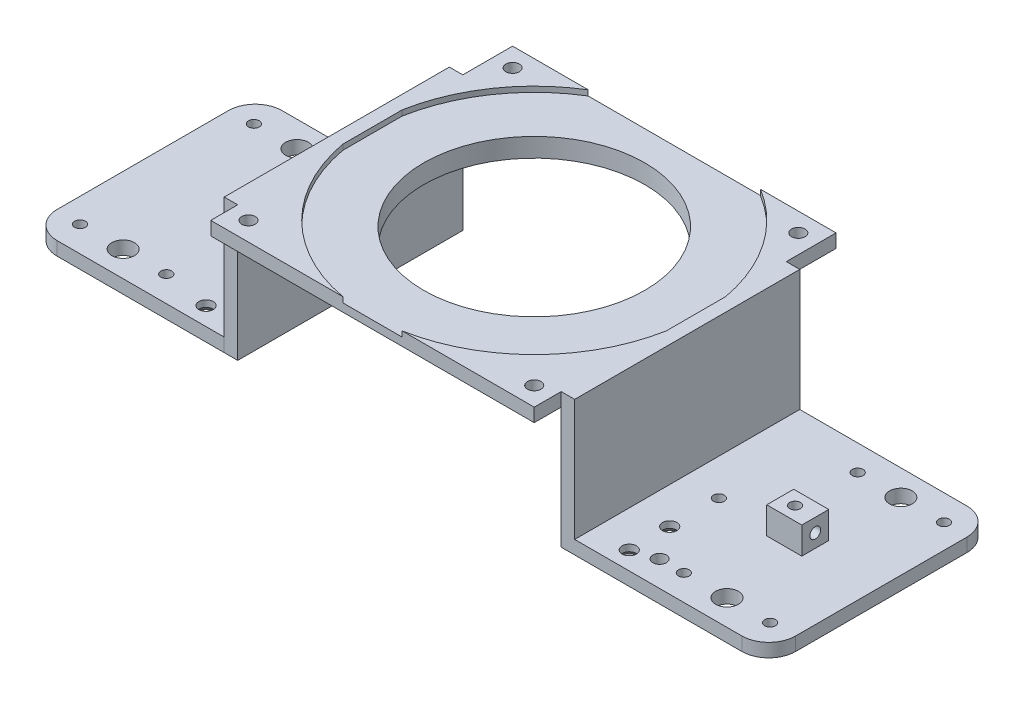
from build123d import *

# Parameters (mm, degrees)
SKETCH1_R                                      = 41
BOSS_EXTRUDE6_DEPTH                            = 5
SKETCH51_R                                     = 61
CUT_EXTRUDE10_DEPTH                            = 2
SKETCH52_R                                     = 2.5
CUT_EXTRUDE11_DEPTH                            = 86
SKETCH39_W                                     = 5
SKETCH39_H                                     = 83.501524227
BOSS_EXTRUDE10_DEPTH                           = 50
SKETCH41_W                                     = 72
SKETCH41_H                                     = 83.501524227
SKETCH41_R                                     = 4.2
SKETCH41_R_2                                   = 2
BOSS_EXTRUDE11_DEPTH                           = 5
FILLET1_R                                      = 10
CSK_FOR_M5_FLAT_HEAD_MACHINE_SCREW2_AT_2_COUNT = 2
CSK_FOR_M5_FLAT_HEAD_MACHINE_SCREW2_AT_2_PITCH = 15
FILLET1_OF_MIRROR6_R                           = 10
SKETCH43_R                                     = 3.5
SKETCH43_R_2                                   = 2
SKETCH43_R_3                                   = 2.5
CUT_EXTRUDE5_DEPTH                             = 10
SKETCH44_W                                     = 13
SKETCH44_H                                     = 10
SKETCH44_R                                     = 2
BOSS_EXTRUDE12_DEPTH                           = 10
SKETCH45_R                                     = 2
CUT_EXTRUDE6_DEPTH                             = 8
BOSS_EXTRUDE13_START                           = 4
SKETCH46_R                                     = 45
SKETCH46_R_2                                   = 41
BOSS_EXTRUDE13_DEPTH                           = 4
CUT_EXTRUDE12_START                            = 2
SKETCH53_R                                     = 45
SKETCH53_R_2                                   = 43
CUT_EXTRUDE12_DEPTH                            = 2


with BuildPart() as part:
    # Sketch1 → Boss-Extrude6 (new body)
    with BuildSketch(Plane(origin=(0, 0, 0), x_dir=(1, 0, 0), z_dir=(0, 1, 0))):
        Polygon((-60, -30), (-60, 30), (-60, 40), (-60, 51.961524227), (-30, 51.961524227), (30, 51.961524227), (60, 51.961524227), (60, 40), (60, 30), (60, -30), (60, -40), (60, -60), (0, -60), (-60, -60), (-60, -40), align=None)
        Circle(SKETCH1_R, mode=Mode.SUBTRACT)
    extrude(amount=BOSS_EXTRUDE6_DEPTH)

    # Sketch51 → Cut-Extrude10 (cut)
    with BuildSketch(Plane(origin=(0, 5, 0), x_dir=(1, 0, 0), z_dir=(0, 1, 0))):
        Circle(SKETCH51_R)
    extrude(amount=-CUT_EXTRUDE10_DEPTH, mode=Mode.SUBTRACT)

    # Sketch52 → Cut-Extrude11 (cut, through all)
    with BuildSketch(Plane(origin=(0, 5, 0), x_dir=(1, 0, 0), z_dir=(0, 1, 0))):
        with Locations((-53, -53)):
            Circle(SKETCH52_R)
        with Locations((-53, 44.961524227)):
            Circle(SKETCH52_R)
        with Locations((53, -53)):
            Circle(SKETCH52_R)
        with Locations((53, 44.961524227)):
            Circle(SKETCH52_R)
    extrude(amount=-CUT_EXTRUDE11_DEPTH, mode=Mode.SUBTRACT)

    # Sketch39 → Boss-Extrude10 (add)
    with BuildSketch(Plane(origin=(0, 5, 0), x_dir=(1, 0, 0), z_dir=(0, 1, 0))):
        with Locations((-62.5, -8.249237886)):
            Rectangle(SKETCH39_W, SKETCH39_H)
    boss_extrude10 = extrude(amount=-BOSS_EXTRUDE10_DEPTH)

    # Mirror1: Boss-Extrude10 across plane
    add(boss_extrude10.mirror(Plane(origin=(0, 0, 0), x_dir=(0, 0, 1), z_dir=(1, 0, 0))))


with BuildPart() as body_2:
    # Sketch41 → Boss-Extrude11 (new body)
    with BuildSketch(Plane.XZ.offset(45)):
        with Locations((-101, 8.249237886)):
            Rectangle(SKETCH41_W, SKETCH41_H)
        with Locations((-112, -24)):
            Circle(SKETCH41_R, mode=Mode.SUBTRACT)
        with Locations((-128, -24)):
            Circle(SKETCH41_R_2, mode=Mode.SUBTRACT)
        with Locations((-96, -24)):
            Circle(SKETCH41_R_2, mode=Mode.SUBTRACT)
        with Locations((-112, 40.5)):
            Circle(SKETCH41_R, mode=Mode.SUBTRACT)
        with Locations((-128, 40.5)):
            Circle(SKETCH41_R_2, mode=Mode.SUBTRACT)
        with Locations((-96, 40.5)):
            Circle(SKETCH41_R_2, mode=Mode.SUBTRACT)
    boss_extrude11 = extrude(amount=-BOSS_EXTRUDE11_DEPTH)

    # Fillet1
    fillet1_edges = [body_2.edges().sort_by_distance(p)[0] for p in [
        (-137, -42.5, 50),
        (-137, -42.5, -33.501524227),
    ]]
    fillet(fillet1_edges, radius=FILLET1_R)

    # Sketch50 → CSK for M5 Flat Head Machine Screw2 (revolve, cut)
    with BuildSketch(Plane(origin=(-78.5, -45, 43.25), x_dir=(0, 0, -1), z_dir=(1, 0, 0))):
        Polygon((0, 0), (0, 50), (2.65, 50), (2.65, 2.55), (5.2, 0), align=None)
    csk_for_m5_flat_head_machine_screw2 = revolve(axis=Axis((-78.5, -51.35, 43.25), (0, 1, 0)), mode=Mode.SUBTRACT)

    # CSK for M5 Flat Head Machine Screw2 at 2: CSK for M5 Flat Head Machine Screw2 ×2
    with Locations(*[(0, 0, -i * CSK_FOR_M5_FLAT_HEAD_MACHINE_SCREW2_AT_2_PITCH) for i in range(1, CSK_FOR_M5_FLAT_HEAD_MACHINE_SCREW2_AT_2_COUNT)]):
        add(csk_for_m5_flat_head_machine_screw2, mode=Mode.SUBTRACT)


with BuildPart() as part_1:
    add(part.part)

    # Mirror6: Boss-Extrude11, CSK for M5 Flat Head Machine Screw2 across plane
    add(boss_extrude11.mirror(Plane(origin=(0, 0, 0), x_dir=(0, 0, 1), z_dir=(1, 0, 0))))
    add(csk_for_m5_flat_head_machine_screw2.mirror(Plane(origin=(0, 0, 0), x_dir=(0, 0, 1), z_dir=(1, 0, 0))), mode=Mode.SUBTRACT)

    # Mirror6 copy 1 sketch → Mirror6 copy 1 (revolve, cut)
    with BuildSketch(Plane(origin=(78.5, -45, 28.25), x_dir=(0, 0, -1), z_dir=(-1, 0, 0))):
        Polygon((0, 0), (0, -50), (2.65, -50), (2.65, -2.55), (5.2, 0), align=None)
    revolve(axis=Axis((78.5, -51.35, 28.25), (0, -1, 0)), mode=Mode.SUBTRACT)

    # Fillet1 of Mirror6
    fillet1_of_mirror6_edges = [part_1.edges().sort_by_distance(p)[0] for p in [
        (137, -42.5, 50),
        (137, -42.5, -33.501524227),
    ]]
    fillet(fillet1_of_mirror6_edges, radius=FILLET1_OF_MIRROR6_R)

    # Sketch43 → Cut-Extrude5 (cut)
    with BuildSketch(Plane(origin=(0, -40, 0), x_dir=(1, 0, 0), z_dir=(0, 1, 0))):
        with Locations((105, -8.25)):
            Circle(SKETCH43_R)
        with Locations((78.5, -10)):
            Circle(SKETCH43_R_2)
        with Locations((87, -40.5)):
            Circle(SKETCH43_R_3)
    extrude(amount=-CUT_EXTRUDE5_DEPTH, mode=Mode.SUBTRACT)

    # Sketch46 → Boss-Extrude13 (add)
    with BuildSketch(Plane.XZ.offset(BOSS_EXTRUDE13_START)):
        Circle(SKETCH46_R)
        Circle(SKETCH46_R_2, mode=Mode.SUBTRACT)
    extrude(amount=-BOSS_EXTRUDE13_DEPTH)

    # Sketch53 → Cut-Extrude12 (cut)
    with BuildSketch(Plane.XZ.offset(CUT_EXTRUDE12_START)):
        Circle(SKETCH53_R)
        Circle(SKETCH53_R_2, mode=Mode.SUBTRACT)
    extrude(amount=-CUT_EXTRUDE12_DEPTH, mode=Mode.SUBTRACT)


with BuildPart() as body_3:
    # Sketch44 → Boss-Extrude12 (new body)
    with BuildSketch(Plane(origin=(0, -40, 0), x_dir=(1, 0, 0), z_dir=(0, 1, 0))):
        with Locations((106, -8.25)):
            Rectangle(SKETCH44_W, SKETCH44_H)
        with Locations((105, -8.25)):
            Circle(SKETCH44_R, mode=Mode.SUBTRACT)
    extrude(amount=BOSS_EXTRUDE12_DEPTH)

    # Sketch45 → Cut-Extrude6 (cut)
    with BuildSketch(Plane.ZY.offset(-112.5)):
        with Locations((8.25, -35)):
            Circle(SKETCH45_R)
    extrude(amount=CUT_EXTRUDE6_DEPTH, mode=Mode.SUBTRACT)


solid = Compound([body_2.part, part_1.part, body_3.part])
